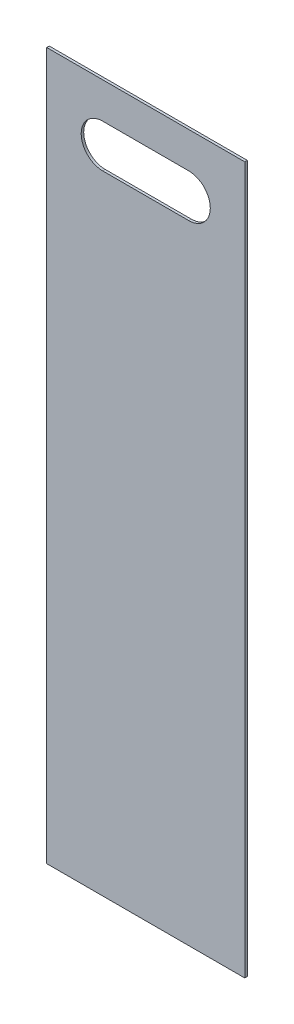
from build123d import *

# Parameters (mm, degrees)
BOSS_EXTRUDE1_DEPTH = 0.2794


with BuildPart() as part:
    # Sketch1 → Boss-Extrude1 (new body)
    with BuildSketch(Plane.XY):
        Polygon((-10.9601, 32.766), (-10.9601, 45.466), (10.9601, 45.466), (10.9601, 32.766), (10.9601, -32.766), (-10.9601, -32.766), align=None)
        with BuildLine():
            Line((4.7625, 36.73475), (-4.7625, 36.73475))
            ThreePointArc((-4.7625, 36.73475), (-7.14375, 39.116), (-4.7625, 41.49725))
            Line((-4.7625, 41.49725), (4.7625, 41.49725))
            ThreePointArc((4.7625, 41.49725), (7.14375, 39.116), (4.7625, 36.73475))
        make_face(mode=Mode.SUBTRACT)
    extrude(amount=BOSS_EXTRUDE1_DEPTH)


solid = part.part
